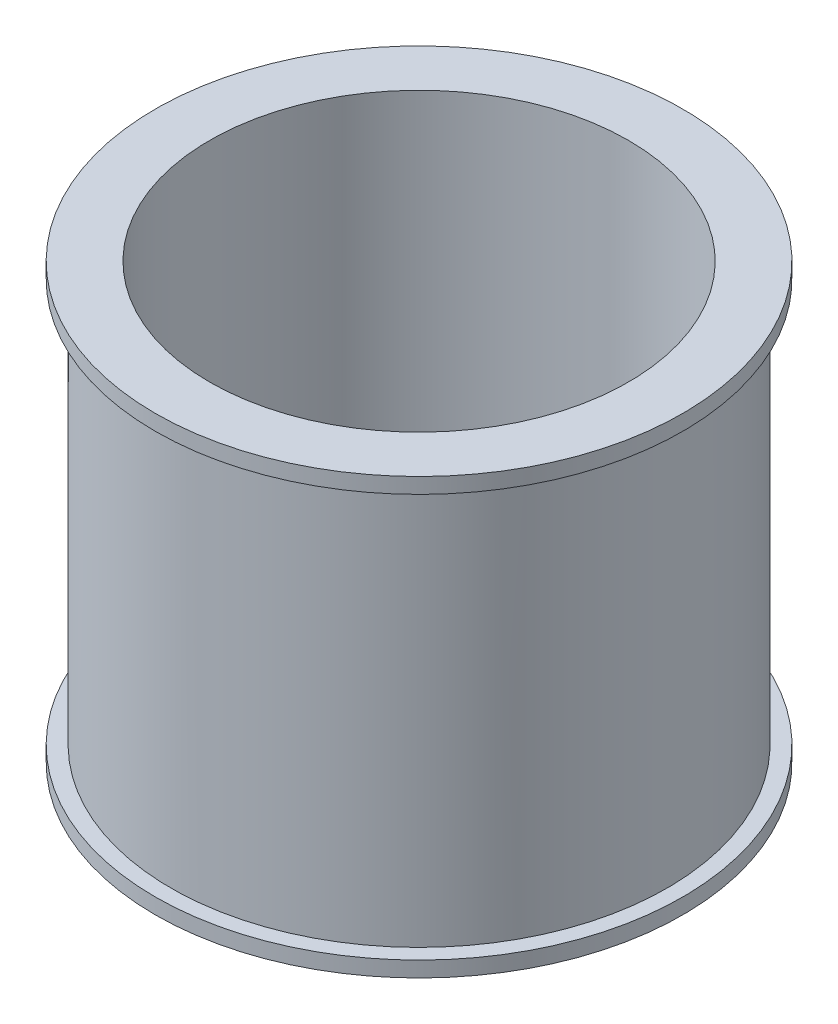
from build123d import *

# Parameters (mm, degrees)
SKETCH1_R           = 4
BOSS_EXTRUDE1_DEPTH = 7
SKETCH2_R           = 3.375
CUT_EXTRUDE1_DEPTH  = 10
BOSS_EXTRUDE2_START = -0.25
SKETCH16_R          = 4.25
SKETCH16_R_2        = 4
BOSS_EXTRUDE2_DEPTH = 0.25


with BuildPart() as part:
    # Sketch1 → Boss-Extrude1 (new body)
    with BuildSketch(Plane(origin=(0, 0, 0), x_dir=(1, 0, 0), z_dir=(0, 1, 0))):
        with Locations(Location((0, 0, 0), (0, 0, 270))):
            Circle(SKETCH1_R)
    extrude(amount=BOSS_EXTRUDE1_DEPTH)

    # Sketch2 → Cut-Extrude1 (cut)
    with BuildSketch(Plane(origin=(0, 7, 0), x_dir=(1, 0, 0), z_dir=(0, 1, 0))):
        with Locations(Location((0, 0, 0), (0, 0, 270))):
            Circle(SKETCH2_R)
    extrude(amount=-CUT_EXTRUDE1_DEPTH, mode=Mode.SUBTRACT)

    # Sketch16 → Boss-Extrude2 (add)
    with BuildSketch(Plane(origin=(0, 7, 0), x_dir=(1, 0, 0), z_dir=(0, 1, 0)).offset(BOSS_EXTRUDE2_START)):
        with Locations(Location((0, 0, 0), (0, 0, 270))):
            Circle(SKETCH16_R)
        with Locations(Location((0, 0, 0), (0, 0, 270))):
            Circle(SKETCH16_R_2, mode=Mode.SUBTRACT)
    boss_extrude2 = extrude(amount=BOSS_EXTRUDE2_DEPTH)

    # Mirror1: Boss-Extrude2 across plane
    add(boss_extrude2.mirror(Plane.ZX.offset(3.5)))


solid = part.part
